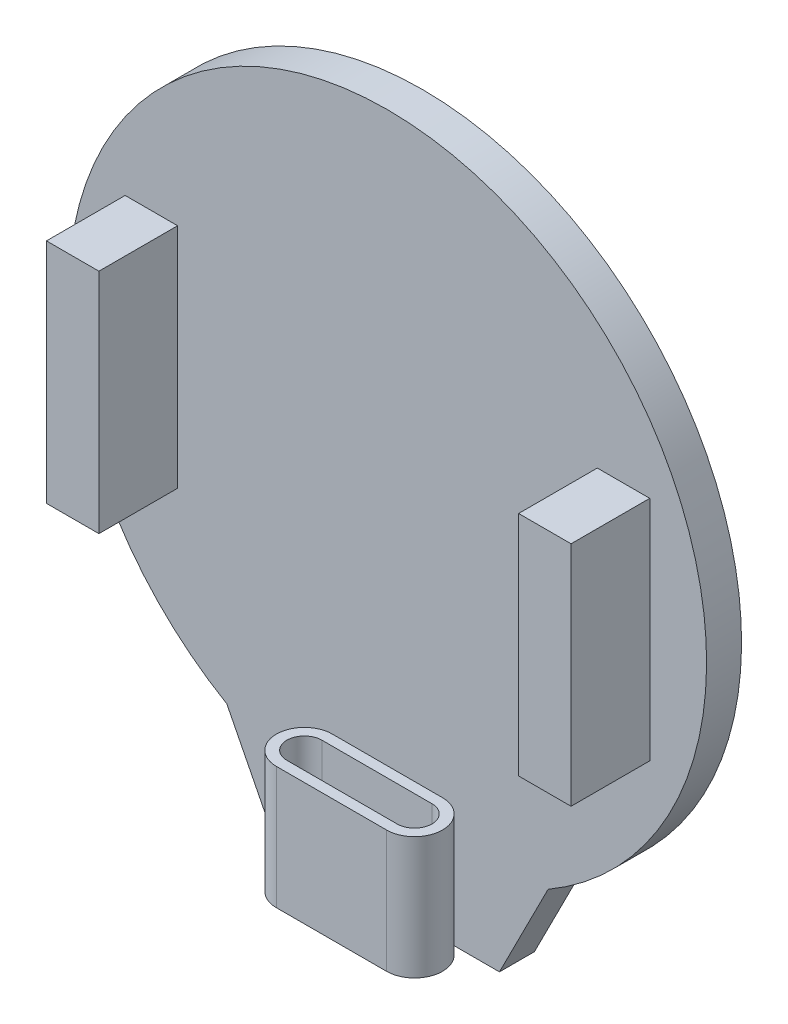
from build123d import *

# Parameters (mm, degrees)
EXTRUDE_1_DEPTH = 2
SKETCH_2_R      = 16.2
EXTRUDE_2_DEPTH = 1.4
SKETCH_3_W      = 3
SKETCH_3_H      = 13
EXTRUDE_3_DEPTH = 4.5
EXTRUDE_4_DEPTH = 7


with BuildPart() as part:
    # 草图1 → 凸台-拉伸1 (new body)
    with BuildSketch(Plane.XY):
        with BuildLine():
            Line((-6.405, -21.250170418), (6.405, -21.250170418))
            Line((6.405, -21.250170418), (9.185, -15.770170418))
            ThreePointArc((9.185, -15.770170418), (0, 18.25), (-9.185, -15.770170418))
            Line((-9.185, -15.770170418), (-6.405, -21.250170418))
        make_face()
    extrude(amount=EXTRUDE_1_DEPTH)

    # 草图2 → 凸台-拉伸2 (add)
    with BuildSketch(Plane(origin=(0, 0, 0), x_dir=(-1, 0, 0), z_dir=(0, 0, -1))):
        Circle(SKETCH_2_R)
    extrude(amount=EXTRUDE_2_DEPTH)

    # 草图3 → 凸台-拉伸3 (add)
    with BuildSketch(Plane.XY.offset(2)):
        with Locations((-13.5, 0)):
            Rectangle(SKETCH_3_W, SKETCH_3_H)
        with Locations((13.5, 0)):
            Rectangle(SKETCH_3_W, SKETCH_3_H)
    extrude(amount=EXTRUDE_3_DEPTH)

    # 草图4 → 凸台-拉伸4 (add)
    with BuildSketch(Plane.XZ.offset(21.250170418)):
        with BuildLine():
            Line((-3.15, 5.2), (3.15, 5.2))
            ThreePointArc((3.15, 5.2), (4.75, 3.6), (3.15, 2))
            Line((3.15, 2), (-3.15, 2))
            ThreePointArc((-3.15, 2), (-4.75, 3.6), (-3.15, 5.2))
        make_face()
        with BuildLine():
            Line((-3.15, 4.6), (3.15, 4.6))
            ThreePointArc((3.15, 4.6), (4.15, 3.6), (3.15, 2.6))
            Line((3.15, 2.6), (-3.15, 2.6))
            ThreePointArc((-3.15, 2.6), (-4.15, 3.6), (-3.15, 4.6))
        make_face(mode=Mode.SUBTRACT)
    extrude(amount=-EXTRUDE_4_DEPTH)


solid = part.part
